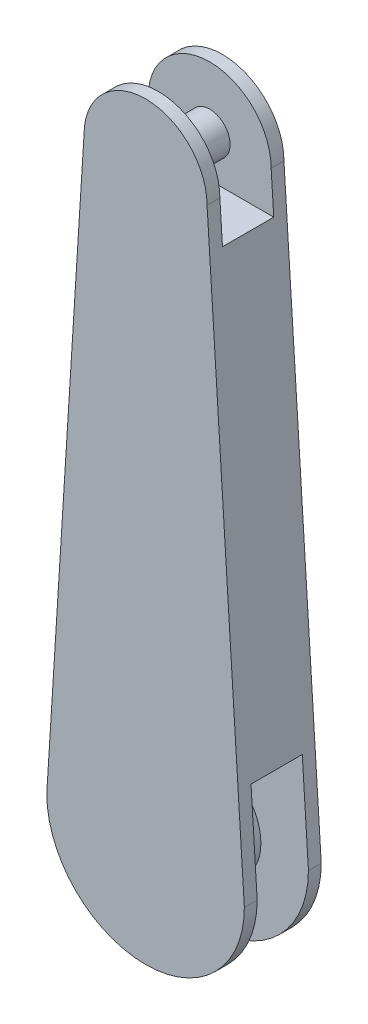
from build123d import *

# Parameters (mm, degrees)
BOSS_EXTRUDE1_DEPTH = 75
SKETCH3_W           = 100
SKETCH3_H           = 382.75
SKETCH3_H_2         = 200
CUT_EXTRUDE1_DEPTH  = 195
SKETCH5_R           = 40
BOSS_EXTRUDE2_DEPTH = 100
SKETCH4_R           = 100
BOSS_EXTRUDE3_DEPTH = 100


with BuildPart() as part:
    # Sketch2 → Boss-Extrude1 (new, symmetric)
    with BuildSketch(Plane.XY):
        with BuildLine():
            Line((120, 1342.75), (192.75, 192.75))
            ThreePointArc((192.75, 192.75), (0, 0), (-192.75, 192.75))
            Line((-192.75, 192.75), (-120, 1342.75))
            ThreePointArc((-120, 1342.75), (0, 1462.75), (120, 1342.75))
        make_face()
    extrude(amount=BOSS_EXTRUDE1_DEPTH, both=True)

    # Sketch3 → Cut-Extrude1 (cut, symmetric)
    with BuildSketch(Plane(origin=(0, 0, 0), x_dir=(0, 0, -1), z_dir=(1, 0, 0))):
        with Locations((0, 191.375)):
            Rectangle(SKETCH3_W, SKETCH3_H)
        with Locations((0, 1362.75)):
            Rectangle(SKETCH3_W, SKETCH3_H_2)
    extrude(amount=CUT_EXTRUDE1_DEPTH, both=True, mode=Mode.SUBTRACT)

    # Sketch5 → Boss-Extrude2 (add)
    with BuildSketch(Plane(origin=(0, 0, 50), x_dir=(-1, 0, 0), z_dir=(0, 0, -1))):
        with Locations(Location((0, 1342.75, 0), (0, 0, 180))):
            Circle(SKETCH5_R)
    extrude(amount=BOSS_EXTRUDE2_DEPTH)

    # Sketch4 → Boss-Extrude3 (add)
    with BuildSketch(Plane(origin=(0, 0, 50), x_dir=(-1, 0, 0), z_dir=(0, 0, -1))):
        with Locations(Location((0, 192.75, 0), (0, 0, 180))):
            Circle(SKETCH4_R)
    extrude(amount=BOSS_EXTRUDE3_DEPTH)


solid = part.part
